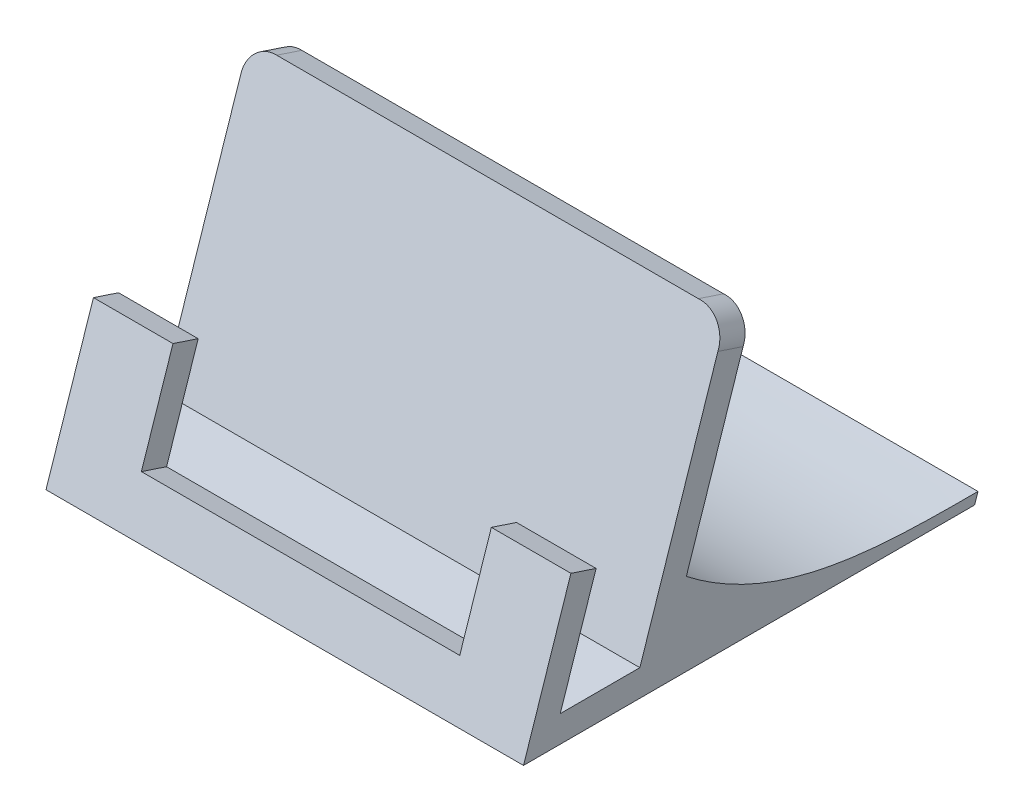
from build123d import *

# Parameters (mm, degrees)
SKETCH1_W           = 90
SKETCH1_H           = 90
BOSS_EXTRUDE1_DEPTH = 25
SKETCH2_W           = 50
SKETCH2_H           = 25
BOSS_EXTRUDE2_DEPTH = 90
CUT_EXTRUDE1_DEPTH  = 114
BOSS_EXTRUDE3_DEPTH = 90
CUT_EXTRUDE2_DEPTH  = 90
CUT_EXTRUDE3_DEPTH  = 7
SKETCH12_W          = 60
SKETCH12_H          = 3.762713397
CUT_EXTRUDE4_DEPTH  = 7
SKETCH13_W          = 60
SKETCH13_H          = 6.597800351
BOSS_EXTRUDE4_DEPTH = 4
SKETCH15_W          = 60
SKETCH15_H          = 4.875511562
BOSS_EXTRUDE5_DEPTH = 6
CUT_EXTRUDE5_DEPTH  = 105
CUT_EXTRUDE6_DEPTH  = 105
CUT_EXTRUDE7_DEPTH  = 105
CUT_EXTRUDE8_DEPTH  = 105
SKETCH20_R          = 5.002398859
BOSS_EXTRUDE6_DEPTH = 5
SKETCH21_R          = 5.013240391
BOSS_EXTRUDE7_DEPTH = 5
CUT_EXTRUDE9_DEPTH  = 110
CUT_EXTRUDE10_DEPTH = 110
BOSS_EXTRUDE8_DEPTH = 90


with BuildPart() as part:
    # Sketch1 → Boss-Extrude1 (new body)
    with BuildSketch(Plane(origin=(0, 0, 0), x_dir=(1, 0, 0), z_dir=(0, 1, 0))):
        with Locations((-396.44486692, -394.733840304)):
            Rectangle(SKETCH1_W, SKETCH1_H)
    extrude(amount=BOSS_EXTRUDE1_DEPTH)

    # Sketch2 → Boss-Extrude2 (add)
    with BuildSketch(Plane(origin=(-351.44486692, 0, 0), x_dir=(0, 0, -1), z_dir=(1, 0, 0))):
        with Locations((-324.733840304, 12.5)):
            Rectangle(SKETCH2_W, SKETCH2_H)
    extrude(amount=-BOSS_EXTRUDE2_DEPTH)

    # Sketch3 → Cut-Extrude1 (cut)
    with BuildSketch(Plane(origin=(-351.44486692, 0, 0), x_dir=(0, 0, -1), z_dir=(1, 0, 0))):
        Polygon((-439.733840304, 0), (-431.428630034, 25), (-426.683614644, 23.423665978), (-432.80411144, 5), (-422.80411144, 5), (-417.80411144, 5), (-409.869768155, 28.88363156), (-456.556935105, 33.347834294), align=None)
    extrude(amount=-CUT_EXTRUDE1_DEPTH, mode=Mode.SUBTRACT)

    # Sketch6 → Boss-Extrude3 (add)
    with BuildSketch(Plane(origin=(-351.44486692, 0, 0), x_dir=(0, 0, -1), z_dir=(1, 0, 0))):
        Polygon((-417.80411144, 5), (-402.036905068, 52.448869357), (-397.292018132, 50.872148719), (-412.958326169, 3.726916659), align=None)
    extrude(amount=-BOSS_EXTRUDE3_DEPTH)

    # Sketch8 → Cut-Extrude2 (cut)
    with BuildSketch(Plane.ZY.offset(441.44486692)):
        Polygon((402.036905068, 52.448869357), (417.80411144, 5), (422.667757436, 11.843524049), (408.096373886, 67.204399508), align=None)
    extrude(amount=-CUT_EXTRUDE2_DEPTH, mode=Mode.SUBTRACT)

    # Sketch11 → Cut-Extrude3 (cut)
    with BuildSketch(Plane(origin=(0, 131.563601718, 396.027305256), x_dir=(1, 0, 0), z_dir=(0, 0.31526680439845073, 0.9490030779952134))):
        Polygon((-396.44486692, -112.290048567), (-366.44486692, -112.290048567), (-366.44486692, -132.290048567), (-426.44486692, -132.290048567), (-426.44486692, -112.290048567), align=None)
    extrude(amount=-CUT_EXTRUDE3_DEPTH, mode=Mode.SUBTRACT)

    # Sketch12 → Cut-Extrude4 (cut)
    with BuildSketch(Plane(origin=(0, 131.563601718, 396.027305256), x_dir=(1, 0, 0), z_dir=(0, 0.31526680439845073, 0.9490030779952134))):
        with Locations((-396.44486692, -134.171405266)):
            Rectangle(SKETCH12_W, SKETCH12_H)
    extrude(amount=-CUT_EXTRUDE4_DEPTH, mode=Mode.SUBTRACT)

    # Sketch13 → Boss-Extrude4 (add)
    with BuildSketch(Plane(origin=(0, 5, 0), x_dir=(1, 0, 0), z_dir=(0, 1, 0))):
        with Locations((-396.44486692, -433.995536892)):
            Rectangle(SKETCH13_W, SKETCH13_H)
    extrude(amount=-BOSS_EXTRUDE4_DEPTH)

    # Sketch15 → Boss-Extrude5 (add)
    with BuildSketch(Plane(origin=(0, 131.563601718, 396.027305256), x_dir=(1, 0, 0), z_dir=(0, 0.31526680439845073, 0.9490030779952134))):
        with Locations((-396.44486692, -133.615006183)):
            Rectangle(SKETCH15_W, SKETCH15_H)
    extrude(amount=-BOSS_EXTRUDE5_DEPTH)

    # Sketch16 → Cut-Extrude5 (cut)
    with BuildSketch(Plane.ZY.offset(441.44486692)):
        Polygon((299.733840304, 25), (405.889304299, 25), (320.938870245, 45.924702762), (282.519842095, 35.688976285), (299.733840304, -6.375653077), (299.733840304, 0), (299.733840304, 13.612271354), align=None)
        Polygon((409.673433828, 13.612271354), (405.889304299, 25), (299.733840304, 25), (299.733840304, 13.612271354), align=None)
    extrude(amount=-CUT_EXTRUDE5_DEPTH, mode=Mode.SUBTRACT)

    # Sketch17 → Cut-Extrude6 (cut)
    with BuildSketch(Plane(origin=(-351.44486692, 0, 0), x_dir=(0, 0, -1), z_dir=(1, 0, 0))):
        Polygon((-354.703637066, 13.612271354), (-354.703637066, -9.141758862), (-285.710269568, -9.141758862), (-285.710269568, 26.661614512), (-354.703637066, 26.661614512), align=None)
    extrude(amount=-CUT_EXTRUDE6_DEPTH, mode=Mode.SUBTRACT)

    # Sketch18 → Cut-Extrude7 (cut)
    with BuildSketch(Plane(origin=(0, 125.526947543, 377.753141183), x_dir=(1, 0, 0), z_dir=(0, 0.3153441274409663, 0.9489773871323255))):
        Polygon((-441.44486692, -77.007186028), (-436.44486692, -77.007186028), (-441.44486692, -82.007186028), align=None)
    extrude(amount=-CUT_EXTRUDE7_DEPTH, mode=Mode.SUBTRACT)

    # Sketch19 → Cut-Extrude8 (cut)
    with BuildSketch(Plane(origin=(0, 125.526947543, 377.753141183), x_dir=(1, 0, 0), z_dir=(0, 0.3153441274409663, 0.9489773871323255))):
        Polygon((-351.44486692, -82.007186028), (-351.44486692, -77.007186028), (-356.44486692, -77.007186028), align=None)
    extrude(amount=-CUT_EXTRUDE8_DEPTH, mode=Mode.SUBTRACT)

    # Sketch20 → Boss-Extrude6 (add)
    with BuildSketch(Plane(origin=(0, 125.526947543, 377.753141183), x_dir=(1, 0, 0), z_dir=(0, 0.3153441274409663, 0.9489773871323255))):
        with Locations((-436.44486692, -82.007186028)):
            Circle(SKETCH20_R)
    extrude(amount=-BOSS_EXTRUDE6_DEPTH)

    # Sketch21 → Boss-Extrude7 (add)
    with BuildSketch(Plane(origin=(0, 125.526947543, 377.753141183), x_dir=(1, 0, 0), z_dir=(0, 0.3153441274409663, 0.9489773871323255))):
        with Locations((-356.44486692, -82.007186028)):
            Circle(SKETCH21_R)
    extrude(amount=-BOSS_EXTRUDE7_DEPTH)

    # Sketch22 → Cut-Extrude9 (cut)
    with BuildSketch(Plane.ZY.offset(441.44486692)):
        with BuildLine():
            Line((352.286663655, 0), (351.925563617, 18.995212977))
            Line((351.925563617, 18.995212977), (405.563075233, 20.014865007))
            Line((405.563075233, 20.014865007), (409.673433828, 13.612271354))
            add(Edge.make_bspline(
                [(409.673433828, 13.612271354), (391.693864934, -0.348112278), (371.968229932, 0.006592141), (352.286663655, 0)],
                knots=[0, 0, 0, 0, 1, 1, 1, 1], degree=3))
        make_face()
    extrude(amount=-CUT_EXTRUDE9_DEPTH, mode=Mode.SUBTRACT)

    # Sketch23 → Cut-Extrude10 (cut)
    with BuildSketch(Plane(origin=(-351.44486692, 0, 0), x_dir=(0, 0, -1), z_dir=(1, 0, 0))):
        Polygon((-432.207797356, 6.794999958), (-432.80411144, 5), (-433.434645049, 3.101993844), (-418.434799695, 3.102045226), (-417.80411144, 5), (-417.309872164, 6.487333538), align=None)
    extrude(amount=-CUT_EXTRUDE10_DEPTH, mode=Mode.SUBTRACT)

    # Sketch24 → Boss-Extrude8 (add)
    with BuildSketch(Plane(origin=(-351.44486692, 0, 0), x_dir=(0, 0, -1), z_dir=(1, 0, 0))):
        Polygon((-439.733840304, 0), (-440.364373913, -1.898006156), (-355.334170675, -1.898006156), (-354.703637066, 0), align=None)
    extrude(amount=-BOSS_EXTRUDE8_DEPTH)


solid = part.part
